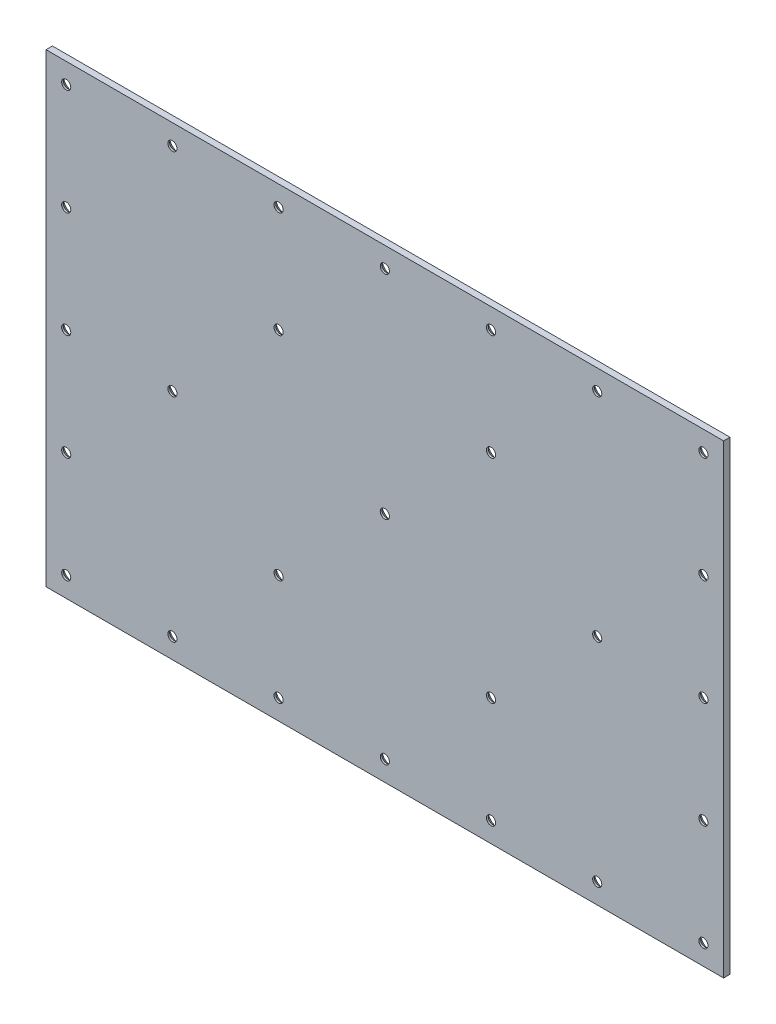
from build123d import *

# Parameters (mm, degrees)
SKETCH_1_W                  = 319
SKETCH_1_H                  = 219
EXTRUDE_1_DEPTH             = 3
PATTERN_LINEAR_3_COUNT      = 7
PATTERN_LINEAR_3_PITCH      = 50
PATTERN_LINEAR_3_COUNT_DIR2 = 5
PATTERN_LINEAR_3_PITCH_DIR2 = 50


with BuildPart() as part:
    # Эскиз1 → Бобышка-Вытянуть1 (new body)
    with BuildSketch(Plane.XY):
        Rectangle(SKETCH_1_W, SKETCH_1_H)
    extrude(amount=EXTRUDE_1_DEPTH)

    # Эскиз6 → Зенковка для винта с полупотайной головкой M42 (revolve, cut)
    with BuildSketch(Plane(origin=(150, -100, 0), x_dir=(0, 1, 0), z_dir=(1, 0, 0))):
        Polygon((0, 0), (0, 3), (2.15, 3), (2.15, 2.15), (4.3, 0), align=None)
    hole_wizard_m42 = revolve(axis=Axis((150, -100, -6.35), (0, 0, 1)), mode=Mode.SUBTRACT)

    # Линейный массив3: Hole Wizard M42 7 × 5, 8 skipped
    with Locations(*[(-i * PATTERN_LINEAR_3_PITCH, j * PATTERN_LINEAR_3_PITCH_DIR2, 0) for i in range(PATTERN_LINEAR_3_COUNT) for j in range(PATTERN_LINEAR_3_COUNT_DIR2) if (i, j) not in ((0, 0), (1, 1), (1, 3), (2, 2), (3, 1), (3, 3), (4, 2), (5, 1), (5, 3))]):
        add(hole_wizard_m42, mode=Mode.SUBTRACT)


solid = part.part
